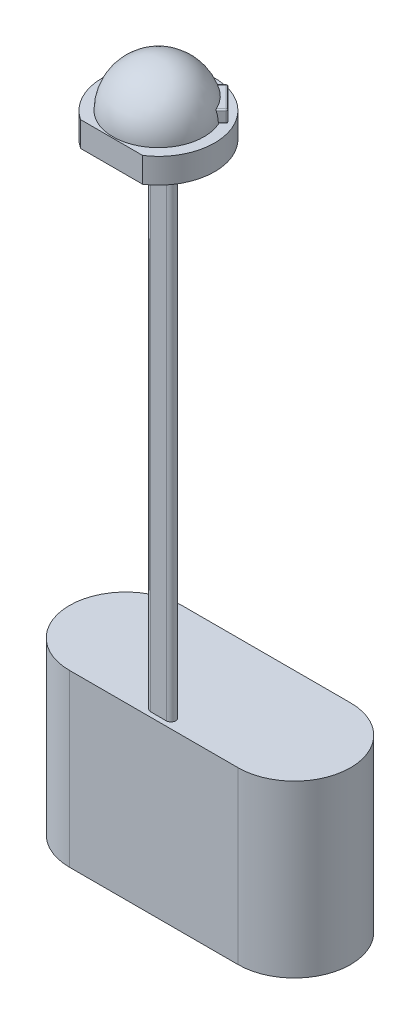
from build123d import *

# Parameters (mm, degrees)
BOSS_EXTRUDE1_DEPTH   = 270
BOSS_EXTRUDE2_DEPTH   = 3
BOSS_EXTRUDE3_DEPTH   = 800
BOSS_EXTRUDE4_DEPTH   = 40
REVOLVE1_ANGLE        = 180
BOSS_EXTRUDE5_DEPTH   = 20
BOSS_EXTRUDE5_2_DEPTH = 20
FILLET1_R             = 2
FILLET2_R             = 2


with BuildPart() as part:
    # Sketch1 → Boss-Extrude1 (new body)
    with BuildSketch(Plane(origin=(0, -8.241432606, 0), x_dir=(1, 0, 0), z_dir=(0, 1, 0))):
        with BuildLine():
            Line((-124.779928143, 83.000032543), (145.220071857, 83.000032543))
            ThreePointArc((145.220071857, 83.000032543), (235.220071857, -6.999967457), (145.220071857, -96.999967457))
            Line((145.220071857, -96.999967457), (-124.779928143, -96.999967457))
            ThreePointArc((-124.779928143, -96.999967457), (-214.779928143, -6.999967457), (-124.779928143, 83.000032543))
        make_face()
        with BuildLine():
            Line((-124.779928143, 80.000032543), (145.220071857, 80.000032543))
            ThreePointArc((145.220071857, 80.000032543), (232.220071857, -6.999967457), (145.220071857, -93.999967457))
            Line((145.220071857, -93.999967457), (-124.779928143, -93.999967457))
            ThreePointArc((-124.779928143, -93.999967457), (-211.779928143, -6.999967457), (-124.779928143, 80.000032543))
        make_face(mode=Mode.SUBTRACT)
    extrude(amount=BOSS_EXTRUDE1_DEPTH)

    # Sketch4 → Boss-Extrude2 (add)
    with BuildSketch(Plane(origin=(0, 261.758567394, 0), x_dir=(1, 0, 0), z_dir=(0, 1, 0))):
        with BuildLine():
            Line((-124.779928143, -96.999967457), (145.220071857, -96.999967457))
            ThreePointArc((145.220071857, -96.999967457), (235.220071857, -6.999967457), (145.220071857, 83.000032543))
            Line((145.220071857, 83.000032543), (-124.779928143, 83.000032543))
            ThreePointArc((-124.779928143, 83.000032543), (-214.779928143, -6.999967457), (-124.779928143, -96.999967457))
        make_face()
    extrude(amount=BOSS_EXTRUDE2_DEPTH)

    # Sketch5 → Boss-Extrude3 (add)
    with BuildSketch(Plane(origin=(0, 264.758567394, 0), x_dir=(1, 0, 0), z_dir=(0, 1, 0))):
        with BuildLine():
            Line((22.720071857, -89.499967457), (-2.279928143, -89.499967457))
            ThreePointArc((-2.279928143, -89.499967457), (-9.779928143, -81.999967457), (-2.279928143, -74.499967457))
            Line((-2.279928143, -74.499967457), (22.720071857, -74.499967457))
            ThreePointArc((22.720071857, -74.499967457), (30.220071857, -81.999967457), (22.720071857, -89.499967457))
        make_face()
    extrude(amount=BOSS_EXTRUDE3_DEPTH)

    # Sketch6 → Boss-Extrude4 (add)
    with BuildSketch(Plane(origin=(0, 1064.758567394, 0), x_dir=(1, 0, 0), z_dir=(0, 1, 0))):
        with BuildLine():
            Line((59.969443713, -164.499967457), (-39.529299998, -164.499967457))
            ThreePointArc((-39.529299998, -164.499967457), (10.220071857, 0.500032543), (59.969443713, -164.499967457))
        make_face()
    extrude(amount=BOSS_EXTRUDE4_DEPTH)

    # Sketch7 → Revolve1 (revolve)
    with BuildSketch(Plane(origin=(0, 1104.758567394, 0), x_dir=(1, 0, 0), z_dir=(0, 1, 0))):
        with BuildLine():
            Line((10.220071857, -18.499967457), (10.220071857, -16.499967457))
            ThreePointArc((10.220071857, -16.499967457), (-62.779928143, -89.499967457), (10.220071857, -162.499967457))
            Line((10.220071857, -162.499967457), (10.220071857, -160.499967457))
            ThreePointArc((10.220071857, -160.499967457), (-60.779928143, -89.499967457), (10.220071857, -18.499967457))
        make_face()
    revolve(axis=Axis((10.220071857, 1104.758567394, 89.499967457), (0, 0, -1)), revolution_arc=REVOLVE1_ANGLE)


with BuildPart() as body_2:
    # Sketch9 → Boss-Extrude5 (new body)
    with BuildSketch(Plane(origin=(0, 1104.758567394, 0), x_dir=(1, 0, 0), z_dir=(0, 1, 0))):
        Polygon((73.859682164, -63.139577763), (84.466283882, -52.532976046), (49.110944823, -17.177636986), (38.504343105, -27.784238704), align=None)
    extrude(amount=BOSS_EXTRUDE5_DEPTH)

    # Fillet1
    fillet1_edges = [body_2.edges().sort_by_distance(p)[0] for p in [
        (66.788614352, 1124.758567394, 34.855306516),
        (43.807643964, 1124.758567394, 22.480937845),
        (43.807643964, 1104.758567394, 22.480937845),
        (66.788614352, 1104.758567394, 34.855306516),
        (79.162983023, 1104.758567394, 57.836276905),
        (38.504343105, 1114.758567394, 27.784238704),
        (49.110944823, 1114.758567394, 17.177636986),
        (84.466283882, 1114.758567394, 52.532976046),
        (73.859682164, 1114.758567394, 63.139577763),
        (79.162983023, 1124.758567394, 57.836276905),
    ]]
    fillet(fillet1_edges, radius=FILLET1_R)


with BuildPart() as body_3:
    # Sketch9 → Boss-Extrude5 2 (new body)
    with BuildSketch(Plane(origin=(0, 1104.758567394, 0), x_dir=(1, 0, 0), z_dir=(0, 1, 0))):
        Polygon((-18.06419939, -27.784238704), (-28.670801108, -17.177636986), (-64.026140167, -52.532976046), (-53.419538449, -63.139577763), align=None)
    extrude(amount=BOSS_EXTRUDE5_2_DEPTH)

    # Fillet2
    fillet2_edges = [body_3.edges().sort_by_distance(p)[0] for p in [
        (-23.367500249, 1104.758567394, 22.480937845),
        (-46.348470637, 1104.758567394, 34.855306516),
        (-58.722839308, 1104.758567394, 57.836276905),
        (-23.367500249, 1124.758567394, 22.480937845),
        (-46.348470637, 1124.758567394, 34.855306516),
        (-58.722839308, 1124.758567394, 57.836276905),
        (-53.419538449, 1114.758567394, 63.139577763),
        (-64.026140167, 1114.758567394, 52.532976046),
        (-28.670801108, 1114.758567394, 17.177636986),
        (-18.06419939, 1114.758567394, 27.784238704),
    ]]
    fillet(fillet2_edges, radius=FILLET2_R)


solid = Compound([part.part, body_2.part, body_3.part])
